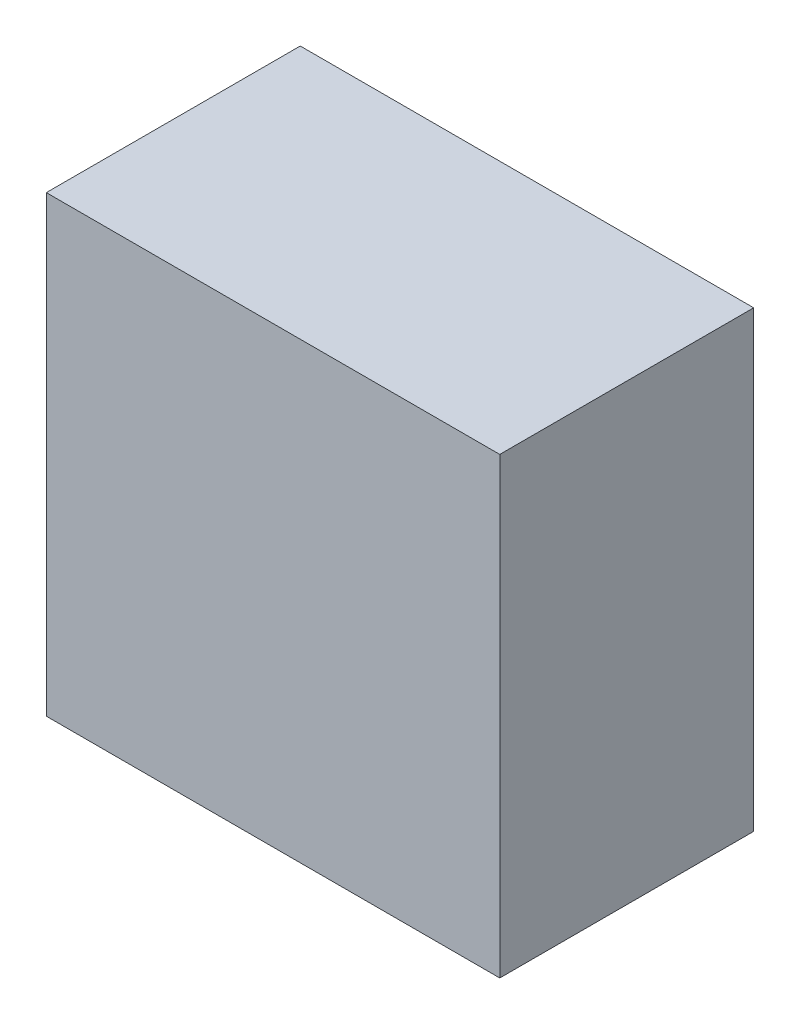
from build123d import *

# Parameters (mm, degrees)
SKETCH1_W           = 125
SKETCH1_H           = 125
BOSS_EXTRUDE1_DEPTH = 35


with BuildPart() as part:
    # Sketch1 → Boss-Extrude1 (new, symmetric)
    with BuildSketch(Plane.XY):
        Rectangle(SKETCH1_W, SKETCH1_H)
    extrude(amount=BOSS_EXTRUDE1_DEPTH, both=True)


solid = part.part
